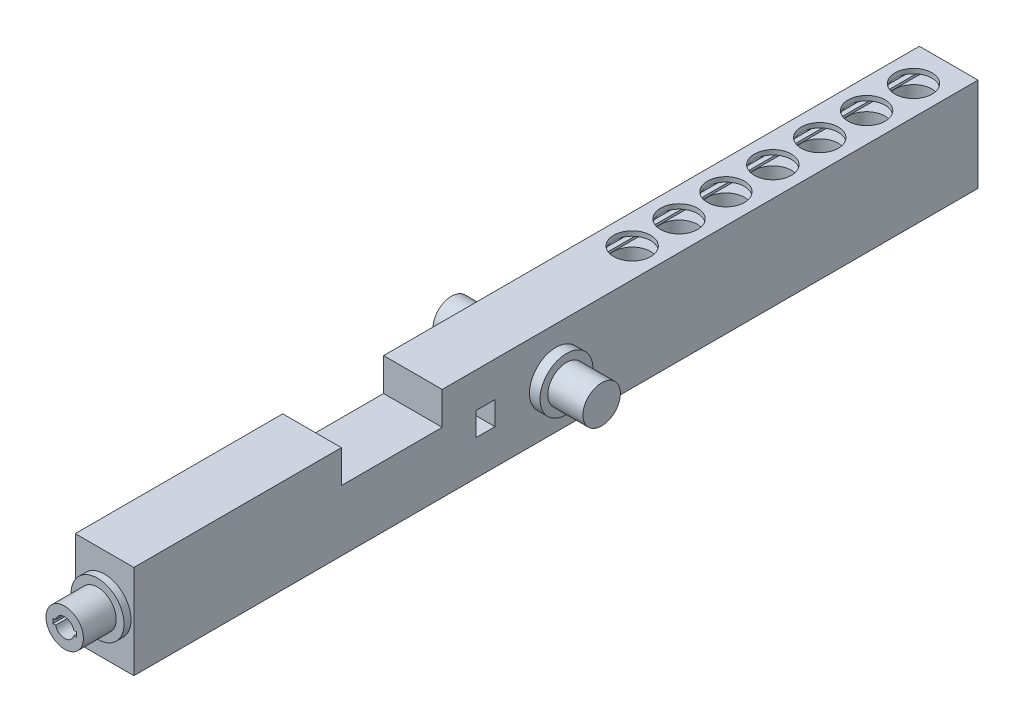
from build123d import *

# Parameters (mm, degrees)
SKETCH1_W           = 12.5
SKETCH1_H           = 180
BOSS_EXTRUDE1_DEPTH = 20
SKETCH2_R           = 5.65
BOSS_EXTRUDE2_DEPTH = 1.5
SKETCH3_R           = 3.99
BOSS_EXTRUDE3_DEPTH = 7
SKETCH4_R           = 5.65
BOSS_EXTRUDE4_DEPTH = 2.25
SKETCH5_R           = 3.99
BOSS_EXTRUDE5_DEPTH = 7.5
BOSS_EXTRUDE6_START = 2.25
SKETCH6_R           = 5.65
BOSS_EXTRUDE6_DEPTH = 2.25
BOSS_EXTRUDE7_START = 7.5
SKETCH7_R           = 3.99
BOSS_EXTRUDE7_DEPTH = 7.5
SKETCH8_R           = 3.95
CUT_EXTRUDE1_DEPTH  = 19
SKETCH9_W           = 8
SKETCH9_H           = 2
CUT_EXTRUDE2_DEPTH  = 72.5
SKETCH10_W          = 11.5
SKETCH10_H          = 1
CUT_EXTRUDE3_DEPTH  = 72.5
SKETCH11_W          = 12.5
SKETCH11_H          = 21.5
CUT_EXTRUDE4_DEPTH  = 7
CUT_EXTRUDE5_DEPTH  = 20
SKETCH14_W          = 4
SKETCH14_H          = 5
CUT_EXTRUDE6_DEPTH  = 12.5


with BuildPart() as part:
    # Sketch1 → Boss-Extrude1 (new body)
    with BuildSketch(Plane(origin=(0, 0, 0), x_dir=(1, 0, 0), z_dir=(0, 1, 0))):
        Rectangle(SKETCH1_W, SKETCH1_H)
    extrude(amount=BOSS_EXTRUDE1_DEPTH)

    # Sketch2 → Boss-Extrude2 (add)
    with BuildSketch(Plane.XY.offset(90)):
        with Locations(Location((0, 10, 0), (0, 0, 180))):
            Circle(SKETCH2_R)
    extrude(amount=BOSS_EXTRUDE2_DEPTH)

    # Sketch3 → Boss-Extrude3 (add)
    with BuildSketch(Plane.XY.offset(91.5)):
        with Locations(Location((0, 10, 0), (0, 0, 180))):
            Circle(SKETCH3_R)
    extrude(amount=BOSS_EXTRUDE3_DEPTH)

    # Sketch4 → Boss-Extrude4 (add)
    with BuildSketch(Plane.ZY.offset(6.25)):
        with Locations(Location((0, 10, 0), (0, 0, 180))):
            Circle(SKETCH4_R)
    extrude(amount=BOSS_EXTRUDE4_DEPTH)

    # Sketch5 → Boss-Extrude5 (add)
    with BuildSketch(Plane.ZY.offset(8.5)):
        with Locations((0, 10)):
            Circle(SKETCH5_R)
    extrude(amount=BOSS_EXTRUDE5_DEPTH)

    # Sketch6 → Boss-Extrude6 (add)
    with BuildSketch(Plane(origin=(6.25, 0, 0), x_dir=(0, 0, -1), z_dir=(1, 0, 0)).offset(BOSS_EXTRUDE6_START)):
        with Locations((0, 10)):
            Circle(SKETCH6_R)
    extrude(amount=-BOSS_EXTRUDE6_DEPTH)

    # Sketch7 → Boss-Extrude7 (add)
    with BuildSketch(Plane(origin=(8.5, 0, 0), x_dir=(0, 0, -1), z_dir=(1, 0, 0)).offset(BOSS_EXTRUDE7_START)):
        with Locations(Location((0, 10, 0), (0, 0, 180))):
            Circle(SKETCH7_R)
    extrude(amount=-BOSS_EXTRUDE7_DEPTH)

    # Sketch8 → Cut-Extrude1 (cut)
    with BuildSketch(Plane(origin=(0, 20, 0), x_dir=(1, 0, 0), z_dir=(0, 1, 0))):
        with Locations(Location((0, 82.5, 0), (0, 0, 270))):
            Circle(SKETCH8_R)
        with Locations(Location((0, 72.5, 0), (0, 0, 270))):
            Circle(SKETCH8_R)
        with Locations(Location((0, 62.5, 0), (0, 0, 270))):
            Circle(SKETCH8_R)
        with Locations(Location((0, 52.5, 0), (0, 0, 270))):
            Circle(SKETCH8_R)
        with Locations(Location((0, 42.5, 0), (0, 0, 270))):
            Circle(SKETCH8_R)
        with Locations(Location((0, 32.5, 0), (0, 0, 270))):
            Circle(SKETCH8_R)
        with Locations(Location((0, 22.5, 0), (0, 0, 270))):
            Circle(SKETCH8_R)
    extrude(amount=-CUT_EXTRUDE1_DEPTH, mode=Mode.SUBTRACT)

    # Sketch9 → Cut-Extrude2 (cut)
    with BuildSketch(Plane(origin=(0, 0, -90), x_dir=(-1, 0, 0), z_dir=(0, 0, -1))):
        with Locations((0, 18)):
            Rectangle(SKETCH9_W, SKETCH9_H)
    extrude(amount=-CUT_EXTRUDE2_DEPTH, mode=Mode.SUBTRACT)

    # Sketch10 → Cut-Extrude3 (cut)
    with BuildSketch(Plane(origin=(0, 0, -90), x_dir=(-1, 0, 0), z_dir=(0, 0, -1))):
        with Locations((0, 18)):
            Rectangle(SKETCH10_W, SKETCH10_H)
    extrude(amount=-CUT_EXTRUDE3_DEPTH, mode=Mode.SUBTRACT)

    # Sketch11 → Cut-Extrude4 (cut)
    with BuildSketch(Plane(origin=(0, 20, 0), x_dir=(1, 0, 0), z_dir=(0, 1, 0))):
        with Locations((0, -35)):
            Rectangle(SKETCH11_W, SKETCH11_H)
    extrude(amount=-CUT_EXTRUDE4_DEPTH, mode=Mode.SUBTRACT)

    # Sketch12 → Cut-Extrude5 (cut)
    with BuildSketch(Plane.XY.offset(98.5)):
        with BuildLine():
            Line((1.936491673, 10.5), (2.5, 10.5))
            Line((2.5, 10.5), (2.5, 9.5))
            Line((2.5, 9.5), (1.936491673, 9.5))
            ThreePointArc((1.936491673, 9.5), (0, 8), (-1.936491673, 9.5))
            Line((-1.936491673, 9.5), (-2.5, 9.5))
            Line((-2.5, 9.5), (-2.5, 10.5))
            Line((-2.5, 10.5), (-1.936491673, 10.5))
            ThreePointArc((-1.936491673, 10.5), (0, 12), (1.936491673, 10.5))
        make_face()
    extrude(amount=-CUT_EXTRUDE5_DEPTH, mode=Mode.SUBTRACT)

    # Sketch14 → Cut-Extrude6 (cut)
    with BuildSketch(Plane(origin=(6.25, 0, 0), x_dir=(0, 0, -1), z_dir=(1, 0, 0))):
        with Locations((-15, 10)):
            Rectangle(SKETCH14_W, SKETCH14_H)
    extrude(amount=-CUT_EXTRUDE6_DEPTH, mode=Mode.SUBTRACT)


solid = part.part
